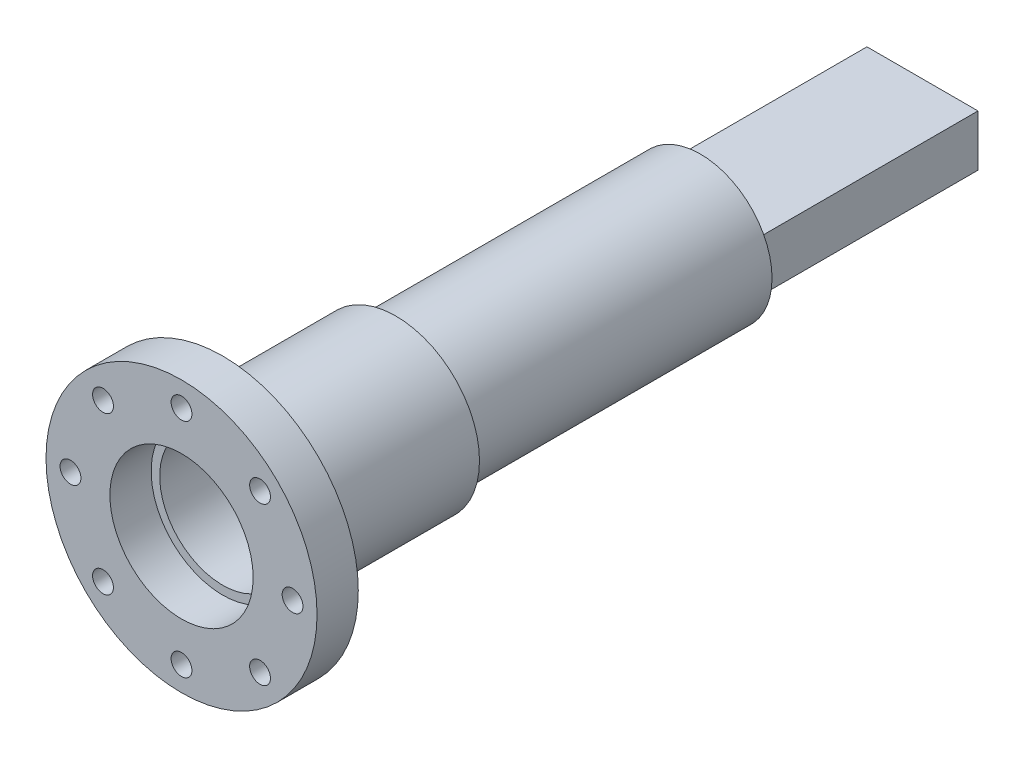
from build123d import *

# Parameters (mm, degrees)
SKETCH1_W           = 46.5000086
SKETCH1_H           = 21.50000018
BOSS_EXTRUDE1_DEPTH = 93.000068
SHELL1_T            = 3.499993
SKETCH2_R           = 29.99994
SKETCH2_R_2         = 26.416
BOSS_EXTRUDE2_DEPTH = 127.4998212
SKETCH18_R          = 56.74999953
SKETCH18_R_2        = 4.362500979
SKETCH18_R_3        = 29.99994
BOSS_EXTRUDE6_DEPTH = 17.272
SKETCH14_R          = 35.000057
SKETCH14_R_2        = 26.416
BOSS_EXTRUDE7_DEPTH = 49.9999508
SKETCH14_6_R        = 35.000057
SKETCH14_6_R_2      = 26.416
BOSS_EXTRUDE8_DEPTH = 22.50000072
SKETCH19_R          = 27.499945
SKETCH19_W          = 39.5000226
SKETCH19_H          = 14.50001418
BOSS_EXTRUDE9_DEPTH = 0.762


with BuildPart() as part:
    # Sketch1 → Boss-Extrude1 (new body)
    with BuildSketch(Plane.XY):
        Rectangle(SKETCH1_W, SKETCH1_H)
    extrude(amount=-BOSS_EXTRUDE1_DEPTH)

    # Shell1 (no face opened: a closed hollow body)
    add(offset(amount=-SHELL1_T, mode=Mode.PRIVATE), mode=Mode.SUBTRACT)



with BuildPart() as body_2:
    # Sketch2 → Boss-Extrude2 (new body)
    with BuildSketch(Plane.XY):
        Circle(SKETCH2_R)
        Circle(SKETCH2_R_2, mode=Mode.SUBTRACT)
    extrude(amount=BOSS_EXTRUDE2_DEPTH)


with BuildPart() as body_3:
    # Sketch18 → Boss-Extrude6 (new body)
    with BuildSketch(Plane.XY.offset(199.99977272)):
        Circle(SKETCH18_R)
        with Locations((0, 46.500034)):
            Circle(SKETCH18_R_2, mode=Mode.SUBTRACT)
        with Locations((32.880489367, 32.880489367)):
            Circle(SKETCH18_R_2, mode=Mode.SUBTRACT)
        with Locations((46.500034, 0)):
            Circle(SKETCH18_R_2, mode=Mode.SUBTRACT)
        with Locations((32.880489367, -32.880489367)):
            Circle(SKETCH18_R_2, mode=Mode.SUBTRACT)
        with Locations((0, -46.500034)):
            Circle(SKETCH18_R_2, mode=Mode.SUBTRACT)
        with Locations((-32.880489367, -32.880489367)):
            Circle(SKETCH18_R_2, mode=Mode.SUBTRACT)
        with Locations((-46.500034, 0)):
            Circle(SKETCH18_R_2, mode=Mode.SUBTRACT)
        with Locations((-32.880489367, 32.880489367)):
            Circle(SKETCH18_R_2, mode=Mode.SUBTRACT)
        Circle(SKETCH18_R_3, mode=Mode.SUBTRACT)
    extrude(amount=BOSS_EXTRUDE6_DEPTH)

    # Sketch14 → Boss-Extrude7 (add)
    with BuildSketch(Plane.XY.offset(149.99982192)):
        Circle(SKETCH14_R)
        Circle(SKETCH14_R_2, mode=Mode.SUBTRACT)
    extrude(amount=BOSS_EXTRUDE7_DEPTH)

    # Sketch14<6> → Boss-Extrude8 (add)
    with BuildSketch(Plane.XY.offset(149.99982192)):
        Circle(SKETCH14_6_R)
        Circle(SKETCH14_6_R_2, mode=Mode.SUBTRACT)
    extrude(amount=-BOSS_EXTRUDE8_DEPTH)


with BuildPart() as part_1:
    add(part.part)

    add(body_2.part)  # Boss-Extrude9 merges body 2
    # Sketch19 → Boss-Extrude9 (add)
    with BuildSketch(Plane.XY):
        Circle(SKETCH19_R)
        Rectangle(SKETCH19_W, SKETCH19_H, mode=Mode.SUBTRACT)
    extrude(amount=BOSS_EXTRUDE9_DEPTH)


solid = Compound([body_3.part, part_1.part])
